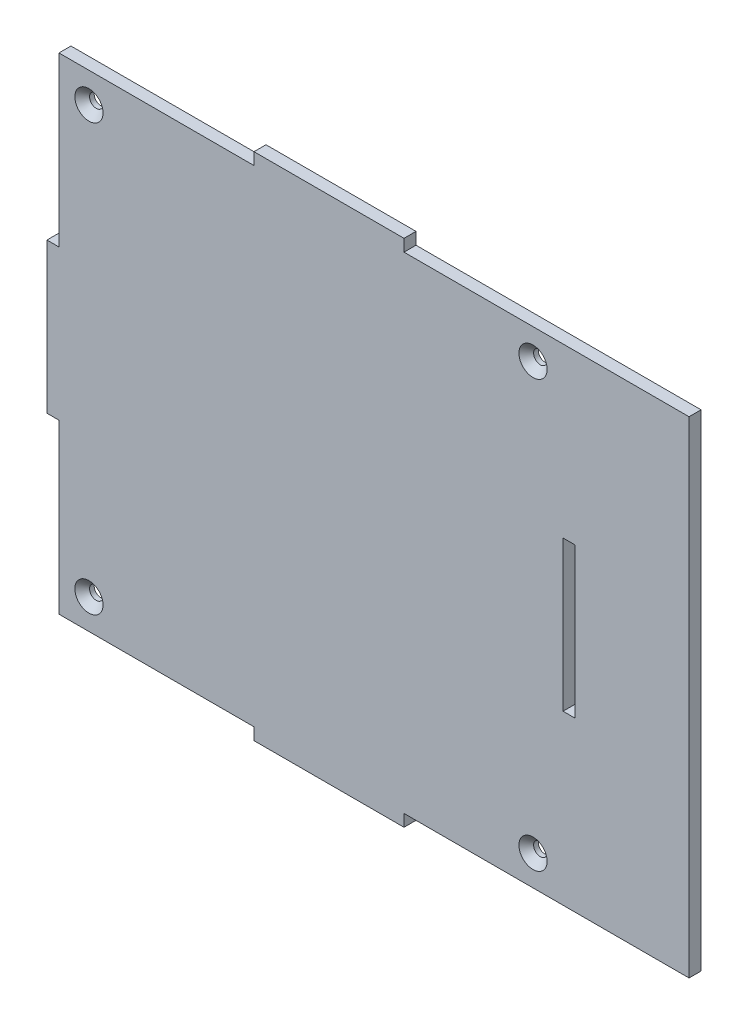
from build123d import *

# Parameters (mm, degrees)
BOSS_EXTRUDE1_DEPTH                          = 4
CUT_EXTRUDE1_REACH                           = 232.298
SKETCH2_W                                    = 4
SKETCH2_H                                    = 50
CSK_FOR_M4_COUNTERSUNK_FLAT_HEAD_SCR_2_COUNT = 2
CSK_FOR_M4_COUNTERSUNK_FLAT_HEAD_SCR_2_PITCH = 148
CSK_FOR_M4_COUNTERSUNK_FLAT_HEAD_SCR_3_COUNT = 2
CSK_FOR_M4_COUNTERSUNK_FLAT_HEAD_SCR_3_PITCH = 205.104851235
CSK_FOR_M4_COUNTERSUNK_FLAT_HEAD_SCR_4_COUNT = 2
CSK_FOR_M4_COUNTERSUNK_FLAT_HEAD_SCR_4_PITCH = 142


with BuildPart() as part:
    # Sketch1 → Boss-Extrude1 (new body)
    with BuildSketch(Plane.XY):
        Polygon((0, 25), (0, 0), (214, 0), (214, 81), (119, 81), (119, 85), (69, 85), (69, 81), (4, 81), (4, 25), align=None)
        Polygon((0, 0), (0, -25), (4, -25), (4, -81), (69, -81), (69, -85), (119, -85), (119, -81), (214, -81), (214, 0), align=None)
    extrude(amount=BOSS_EXTRUDE1_DEPTH)

    # Sketch2 → Cut-Extrude1 (cut, up to next)
    with BuildSketch(Plane.XY.offset(4), mode=Mode.PRIVATE) as cut_extrude1_sk1:
        with Locations((174, 0)):
            Rectangle(SKETCH2_W, SKETCH2_H)
    cut_extrude1_tool1 = extrude(cut_extrude1_sk1.sketch, amount=-CUT_EXTRUDE1_REACH, mode=Mode.PRIVATE) & part.part
    add(cut_extrude1_tool1.solids().sort_by_distance((174, 0, 4))[0], mode=Mode.SUBTRACT)

    # Sketch4 → CSK for M4 Countersunk Flat Head Screw1 (revolve, cut)
    with BuildSketch(Plane(origin=(14, 71, 4), x_dir=(0, -1, 0), z_dir=(1, 0, 0))):
        Polygon((0, 0), (0, 4), (2.25, 4), (2.25, 2.45), (4.7, 0), align=None)
    csk_for_m4_countersunk_flat_head_screw1 = revolve(axis=Axis((14, 71, 10.35), (0, 0, -1)), mode=Mode.SUBTRACT)

    # CSK for M4 Countersunk Flat Head Scr 2: CSK for M4 Countersunk Flat Head Screw1 ×2
    with Locations(*[(i * CSK_FOR_M4_COUNTERSUNK_FLAT_HEAD_SCR_2_PITCH, 0, 0) for i in range(1, CSK_FOR_M4_COUNTERSUNK_FLAT_HEAD_SCR_2_COUNT)]):
        add(csk_for_m4_countersunk_flat_head_screw1, mode=Mode.SUBTRACT)

    # CSK for M4 Countersunk Flat Head Scr 3: CSK for M4 Countersunk Flat Head Screw1 ×2
    with Locations(*[Vector(0.7215821522946791, -0.6923288217962462, 0) * (i * CSK_FOR_M4_COUNTERSUNK_FLAT_HEAD_SCR_3_PITCH) for i in range(1, CSK_FOR_M4_COUNTERSUNK_FLAT_HEAD_SCR_3_COUNT)]):
        add(csk_for_m4_countersunk_flat_head_screw1, mode=Mode.SUBTRACT)

    # CSK for M4 Countersunk Flat Head Scr 4: CSK for M4 Countersunk Flat Head Screw1 ×2
    with Locations(*[(0, -i * CSK_FOR_M4_COUNTERSUNK_FLAT_HEAD_SCR_4_PITCH, 0) for i in range(1, CSK_FOR_M4_COUNTERSUNK_FLAT_HEAD_SCR_4_COUNT)]):
        add(csk_for_m4_countersunk_flat_head_screw1, mode=Mode.SUBTRACT)


solid = part.part
